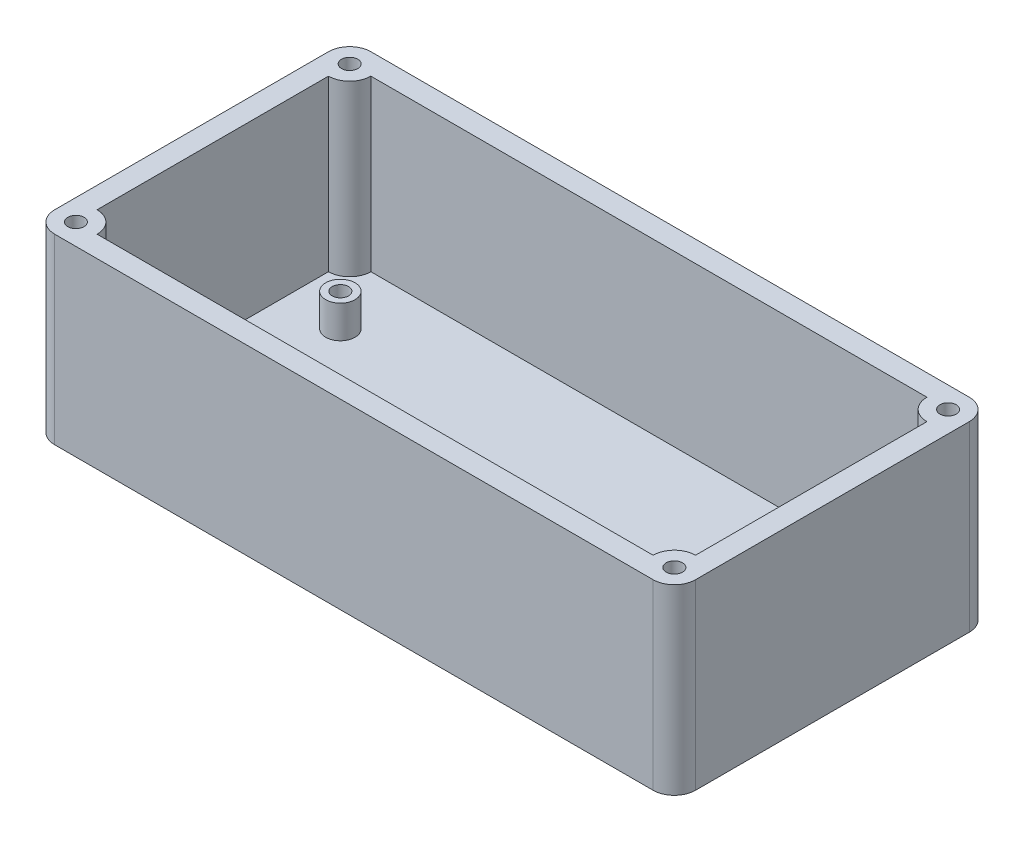
from build123d import *

# Parameters (mm, degrees)
SKETCH1_W           = 126.755144
SKETCH1_H           = 63.5
BOSS_EXTRUDE1_DEPTH = 2.54
SKETCH2_R           = 1.5875
BOSS_EXTRUDE2_DEPTH = 33
SKETCH2_4_W         = 126.755144
SKETCH2_4_H         = 63.5
CUT_EXTRUDE1_DEPTH  = 79.190658858
SKETCH4_R           = 2.8575
SKETCH4_R_2         = 1.5875
BOSS_EXTRUDE3_DEPTH = 6.35


with BuildPart() as part:
    # Sketch1 → Boss-Extrude1 (new body)
    with BuildSketch(Plane(origin=(0, 0, 0), x_dir=(1, 0, 0), z_dir=(0, 1, 0))):
        Rectangle(SKETCH1_W, SKETCH1_H)
    extrude(amount=BOSS_EXTRUDE1_DEPTH)

    # Sketch2 → Boss-Extrude2 (add)
    with BuildSketch(Plane(origin=(0, 2.54, 0), x_dir=(1, 0, 0), z_dir=(0, 1, 0))):
        with BuildLine():
            ThreePointArc((62.425072, 26.67), (61.216155239, 29.588583239), (58.297572, 30.7975))
            Line((58.297572, 30.7975), (-58.297572, 30.7975))
            ThreePointArc((-58.297572, 30.7975), (-61.216155239, 29.588583239), (-62.425072, 26.67))
            Line((-62.425072, 26.67), (-62.425072, -26.67))
            ThreePointArc((-62.425072, -26.67), (-61.216155239, -29.588583239), (-58.297572, -30.7975))
            Line((-58.297572, -30.7975), (58.297572, -30.7975))
            ThreePointArc((58.297572, -30.7975), (61.216155239, -29.588583239), (62.425072, -26.67))
            Line((62.425072, -26.67), (62.425072, 26.67))
        make_face()
        with Locations((58.297572, 26.67)):
            Circle(SKETCH2_R, mode=Mode.SUBTRACT)
        with BuildLine():
            ThreePointArc((54.170072, 26.67), (55.378988761, 23.751416761), (58.297572, 22.5425))
            Line((58.297572, 22.5425), (58.297572, -22.5425))
            ThreePointArc((58.297572, -22.5425), (55.378988761, -23.751416761), (54.170072, -26.67))
            Line((54.170072, -26.67), (-54.170072, -26.67))
            ThreePointArc((-54.170072, -26.67), (-55.378988761, -23.751416761), (-58.297572, -22.5425))
            Line((-58.297572, -22.5425), (-58.297572, 22.5425))
            ThreePointArc((-58.297572, 22.5425), (-55.378988761, 23.751416761), (-54.170072, 26.67))
            Line((-54.170072, 26.67), (54.170072, 26.67))
        make_face(mode=Mode.SUBTRACT)
        with Locations((-58.297572, 26.67)):
            Circle(SKETCH2_R, mode=Mode.SUBTRACT)
        with Locations((58.297572, -26.67)):
            Circle(SKETCH2_R, mode=Mode.SUBTRACT)
        with Locations((-58.297572, -26.67)):
            Circle(SKETCH2_R, mode=Mode.SUBTRACT)
    extrude(amount=BOSS_EXTRUDE2_DEPTH)

    # Sketch2<4> → Cut-Extrude1 (cut, through all)
    with BuildSketch(Plane(origin=(0, 2.54, 0), x_dir=(1, 0, 0), z_dir=(0, 1, 0))):
        Rectangle(SKETCH2_4_W, SKETCH2_4_H)
        with BuildLine():
            ThreePointArc((58.297572, 30.7975), (61.216155239, 29.588583239), (62.425072, 26.67))
            Line((62.425072, 26.67), (62.425072, -26.67))
            ThreePointArc((62.425072, -26.67), (61.216155239, -29.588583239), (58.297572, -30.7975))
            Line((58.297572, -30.7975), (-58.297572, -30.7975))
            ThreePointArc((-58.297572, -30.7975), (-61.216155239, -29.588583239), (-62.425072, -26.67))
            Line((-62.425072, -26.67), (-62.425072, 26.67))
            ThreePointArc((-62.425072, 26.67), (-61.216155239, 29.588583239), (-58.297572, 30.7975))
            Line((-58.297572, 30.7975), (58.297572, 30.7975))
        make_face(mode=Mode.SUBTRACT)
    extrude(amount=-CUT_EXTRUDE1_DEPTH, mode=Mode.SUBTRACT)

    # Sketch4 → Boss-Extrude3 (add)
    # profile 1 of 4: a face of its own
    with BuildSketch(Plane(origin=(0, 2.54, 0), x_dir=(1, 0, 0), z_dir=(0, 1, 0))):
        with Locations((-47.498, 14.0589)):
            Circle(SKETCH4_R)
        with Locations((-47.498, 14.0589)):
            Circle(SKETCH4_R_2, mode=Mode.SUBTRACT)
    # profile 2 of 4: a face of its own
    with BuildSketch(Plane(origin=(0, 2.54, 0), x_dir=(1, 0, 0), z_dir=(0, 1, 0))):
        with Locations((-47.498, -14.0589)):
            Circle(SKETCH4_R)
        with Locations((-47.498, -14.0589)):
            Circle(SKETCH4_R_2, mode=Mode.SUBTRACT)
    # profile 3 of 4: a face of its own
    with BuildSketch(Plane(origin=(0, 2.54, 0), x_dir=(1, 0, 0), z_dir=(0, 1, 0))):
        with Locations((47.498, -14.0589)):
            Circle(SKETCH4_R)
        with Locations((47.498, -14.0589)):
            Circle(SKETCH4_R_2, mode=Mode.SUBTRACT)
    # profile 4 of 4: a face of its own
    with BuildSketch(Plane(origin=(0, 2.54, 0), x_dir=(1, 0, 0), z_dir=(0, 1, 0))):
        with Locations((47.498, 14.0589)):
            Circle(SKETCH4_R)
        with Locations((47.498, 14.0589)):
            Circle(SKETCH4_R_2, mode=Mode.SUBTRACT)
    extrude(amount=BOSS_EXTRUDE3_DEPTH)


solid = part.part
